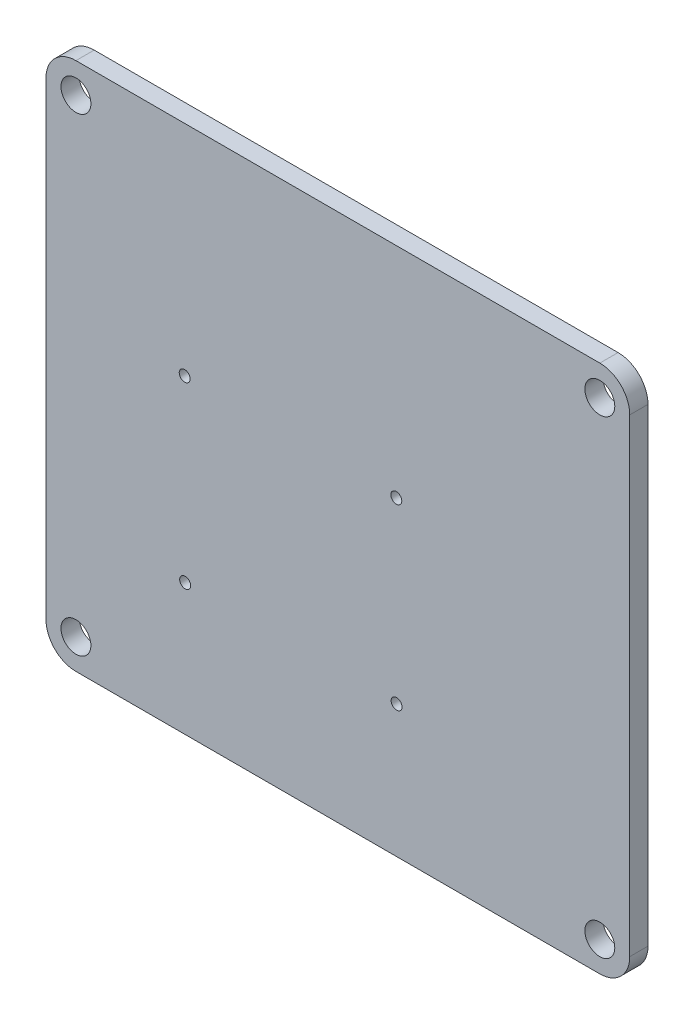
from build123d import *

# Parameters (mm, degrees)
CROQUIS1_R              = 4.1
SALIENTE_EXTRUIR1_DEPTH = 5
CROQUIS2_R              = 1.5
CORTAR_EXTRUIR1_DEPTH   = 10


with BuildPart() as part:
    # Croquis1 → Saliente-Extruir1 (new body)
    with BuildSketch(Plane(origin=(0, 0, 0), x_dir=(0, 1, 0), z_dir=(0, 0, 1))):
        with BuildLine():
            ThreePointArc((-72.5, 71.8), (-70.098275606, 77.598275606), (-64.3, 80))
            Line((-64.3, 80), (64.3, 80))
            ThreePointArc((64.3, 80), (70.098275606, 77.598275606), (72.5, 71.8))
            Line((72.5, 71.8), (72.5, -71.8))
            ThreePointArc((72.5, -71.8), (70.098275606, -77.598275606), (64.3, -80))
            Line((64.3, -80), (-64.3, -80))
            ThreePointArc((-64.3, -80), (-70.098275606, -77.598275606), (-72.5, -71.8))
            Line((-72.5, -71.8), (-72.5, 71.8))
        make_face()
        with Locations(Location((-64.3, -71.8, 0), (0, 0, 270))):
            Circle(CROQUIS1_R, mode=Mode.SUBTRACT)
        with Locations(Location((64.3, -71.8, 0), (0, 0, 270))):
            Circle(CROQUIS1_R, mode=Mode.SUBTRACT)
        with Locations(Location((64.3, 71.8, 0), (0, 0, 270))):
            Circle(CROQUIS1_R, mode=Mode.SUBTRACT)
        with Locations(Location((-64.3, 71.8, 0), (0, 0, 270))):
            Circle(CROQUIS1_R, mode=Mode.SUBTRACT)
    extrude(amount=SALIENTE_EXTRUIR1_DEPTH)

    # Croquis2 → Cortar-Extruir1 (cut)
    with BuildSketch(Plane(origin=(0, 0, 5), x_dir=(0, -1, 0), z_dir=(0, 0, 1))):
        with Locations(Location((-12.573190408, -41.986630744, 0), (0, 0, 90))):
            Circle(CROQUIS2_R)
        with Locations(Location((-12.618499373, 16.013437897, 0), (0, 0, 90))):
            Circle(CROQUIS2_R)
        with Locations(Location((36.241518275, 16.085874272, 0), (0, 0, 90))):
            Circle(CROQUIS2_R)
        with Locations(Location((36.426655653, -41.863805612, 0), (0, 0, 90))):
            Circle(CROQUIS2_R)
    extrude(amount=-CORTAR_EXTRUIR1_DEPTH, mode=Mode.SUBTRACT)


solid = part.part
